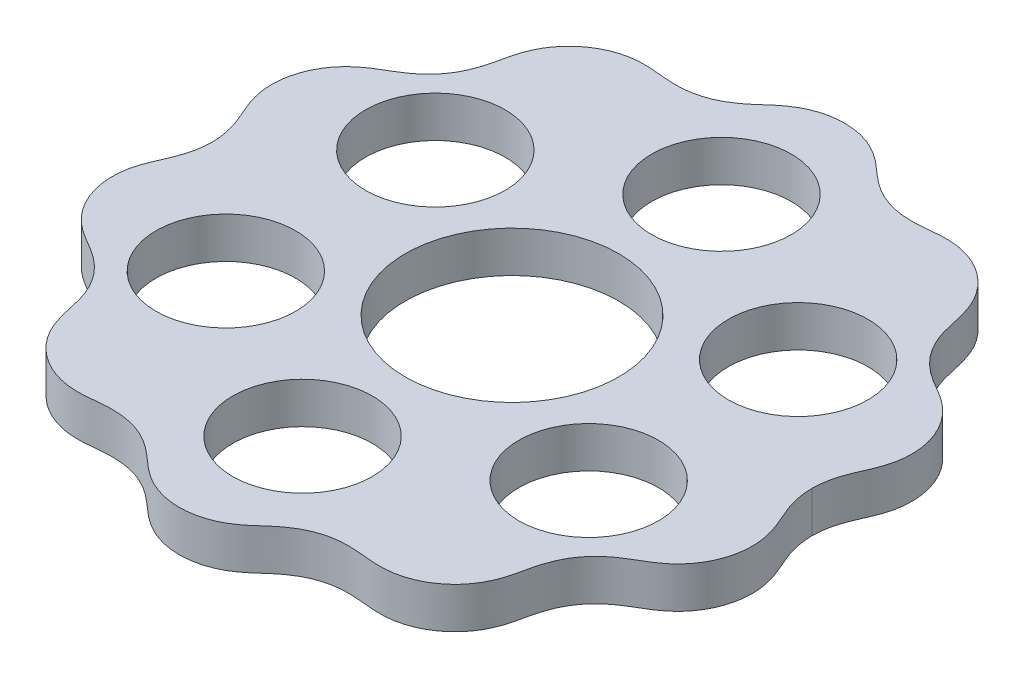
from build123d import *

# Parameters (mm, degrees)
SKETCH1_R           = 13
SKETCH1_R_2         = 8.5
BOSS_EXTRUDE1_DEPTH = 5


with BuildPart() as part:
    # Sketch1 → Boss-Extrude1 (new body)
    with BuildSketch(Plane(origin=(0, 0, 0), x_dir=(1, 0, 0), z_dir=(0, 1, 0))):
        with BuildLine():
            add(Edge.make_bspline(
                [(36.5, 0), (36.5, -0.048499305), (36.500946474, -0.144120136), (36.505205639, -0.349195993), (36.516548144, -0.571582738), (36.53776893, -0.854430115), (36.574407998, -1.196752002), (36.62809738, -1.556988295), (36.70127876, -1.938208043), (36.78047365, -2.281954505), (36.861329003, -2.590026625), (36.973593296, -2.971756615), (37.124850001, -3.424875263), (37.335057521, -3.978884819), (37.610804689, -4.630454515), (37.912979272, -5.308786827), (38.217993537, -6.024773331), (38.579337976, -7.000673113), (38.903566381, -8.266221267), (39.040360932, -9.835827251), (38.833195825, -11.619336074), (38.300146641, -13.287501244), (37.486961222, -14.788321278), (36.519443961, -15.985374971), (35.463247749, -16.921686084), (34.480633006, -17.584395869), (33.651986164, -18.070393448), (32.741397785, -18.599880286), (31.745814237, -19.23037768), (30.644081106, -20.103969946), (29.551914438, -21.316953148), (28.709876259, -22.688378726), (28.129188952, -24.127329092), (27.764036764, -25.53676255), (27.498568237, -26.872010136), (27.14459296, -28.24566423), (26.585858616, -29.613191611), (25.753833767, -30.946724523), (24.630275661, -32.173887031), (23.304067671, -33.178476098), (21.818707229, -33.928039056), (20.354428633, -34.356223626), (18.980021188, -34.522492919), (17.810145148, -34.508679014), (16.856619883, -34.426627197), (15.978233577, -34.333926373), (15.170927755, -34.265741371), (14.149802015, -34.229580128), (12.916311546, -34.297819177), (11.49268827, -34.581382628), (10.018707632, -35.167894044), (8.730716825, -35.94686999), (7.616704888, -36.833430943), (6.627661642, -37.741061624), (5.549118095, -38.667467053), (4.288853719, -39.488783224), (2.83273482, -40.115486753), (1.209906645, -40.482844808), (-0.452411505, -40.551448925), (-2.099959875, -40.319988007), (-3.516029788, -39.847376882), (-4.684831629, -39.236604984), (-5.595122009, -38.603332332), (-6.291293195, -38.03136891), (-6.935196982, -37.455611034), (-7.552937159, -36.905280935), (-8.3720822, -36.227490452), (-9.417339699, -35.501645102), (-10.744745036, -34.835364198), (-12.274940897, -34.396213159), (-13.568324156, -34.246071291), (-14.609253635, -34.240736665), (-15.418369646, -34.285553755), (-16.096609715, -34.346726816), (-16.983957337, -34.439047454), (-18.129700574, -34.534198807), (-19.514247662, -34.499663354), (-21.100124923, -34.177722278), (-22.642688121, -33.554292595), (-24.047237509, -32.662289917), (-25.268485598, -31.532537595), (-26.154336533, -30.347709032), (-26.756076077, -29.20476342), (-27.137211283, -28.192212286), (-27.376331213, -27.351346043), (-27.564158904, -26.521994318), (-27.736255611, -25.71290243), (-27.9936462, -24.634267957), (-28.399117079, -23.379440462), (-29.076792687, -22.004837755), (-30.054056647, -20.718767709), (-31.078771932, -19.746027017), (-32.039482, -19.04146275), (-32.864050638, -18.52796692), (-33.790814113, -17.989908183), (-34.820371489, -17.38242567), (-35.961313043, -16.537601472), (-37.086556652, -15.342606474), (-37.986548491, -13.943319085), (-38.618524242, -12.404128407), (-38.963667013, -10.776717844), (-39.002753109, -9.320975979), (-38.844934454, -8.085734909), (-38.592561063, -7.081267912), (-38.326228914, -6.29696863), (-38.011335485, -5.531557624), (-37.674927383, -4.77594876), (-37.378377228, -4.087797522), (-37.136778411, -3.461265107), (-36.948914251, -2.898248212), (-36.825242681, -2.464456921), (-36.734418474, -2.088562142), (-36.661575892, -1.734972023), (-36.604229284, -1.403741901), (-36.561095025, -1.084527578), (-36.530996656, -0.773408388), (-36.51357757, -0.520248866), (-36.504270411, -0.30979969), (-36.50077644, -0.13220069), (-36.5, -0.043927313), (-36.5, 0)],
                knots=[0.075291946, 0.075291946, 0.075291946, 0.075291946, 0.075291946, 0.076789614, 0.078287282, 0.07978495, 0.081282618, 0.084277954, 0.08727329, 0.089360772, 0.091448255, 0.093535738, 0.09562322, 0.099798186, 0.103973151, 0.109075131, 0.11417711, 0.11927909, 0.12438107, 0.136358468, 0.148336576, 0.160314307, 0.171165011, 0.182015901, 0.19286658, 0.200455433, 0.208044287, 0.213054353, 0.21806442, 0.228084552, 0.238937008, 0.249793369, 0.260645765, 0.270063658, 0.279481551, 0.287924265, 0.29636698, 0.307216588, 0.31806735, 0.328918293, 0.339769011, 0.350619262, 0.361470141, 0.368707076, 0.375944011, 0.381255238, 0.386566466, 0.391877694, 0.397188922, 0.408043704, 0.418896938, 0.42975045, 0.43856656, 0.447382671, 0.456176825, 0.464970979, 0.475821103, 0.486671615, 0.497522231, 0.508373237, 0.519223851, 0.530073652, 0.536457884, 0.542842116, 0.54826674, 0.553691365, 0.55911599, 0.564540614, 0.576145954, 0.586999876, 0.597853142, 0.606065959, 0.610172367, 0.614278775, 0.619102733, 0.62392669, 0.633574604, 0.644425041, 0.655275871, 0.666126278, 0.676977072, 0.687828191, 0.698678662, 0.70471008, 0.710741499, 0.716165428, 0.721589356, 0.727013285, 0.732437214, 0.745249936, 0.756104619, 0.766960924, 0.774569677, 0.78217843, 0.787303815, 0.7924292, 0.802679969, 0.813530568, 0.824380707, 0.835231117, 0.846082101, 0.856932921, 0.867783145, 0.873212041, 0.878640937, 0.884065114, 0.889489291, 0.894913468, 0.900337645, 0.90371728, 0.907096914, 0.910476548, 0.912166365, 0.913856182, 0.91656915, 0.919282118, 0.920638602, 0.921995086, 0.92335157, 0.924708054, 0.924708054, 0.924708054, 0.924708054, 0.924708054], degree=4))
            add(Edge.make_bspline(
                [(-36.5, 0), (-36.5, 0.048499305), (-36.500709854, 0.120347377), (-36.503076032, 0.248821581), (-36.509459135, 0.430805007), (-36.518670462, 0.600909868), (-36.537767816, 0.853780444), (-36.574410609, 1.197161726), (-36.628092737, 1.556776711), (-36.70128534, 1.938275134), (-36.798317842, 2.359473017), (-36.924362877, 2.820443145), (-37.096624147, 3.350360221), (-37.335050856, 3.978935622), (-37.610808448, 4.630425207), (-37.912977339, 5.30880264), (-38.217994227, 6.024766679), (-38.579337761, 7.000676775), (-38.903566296, 8.266218611), (-39.040361318, 9.835829449), (-38.83319516, 11.619334121), (-38.300147751, 13.287503552), (-37.486959297, 14.788317854), (-36.51944727, 15.985380477), (-35.463241983, 16.921676737), (-34.480643682, 17.584412987), (-33.651966589, 18.070362205), (-32.906545987, 18.503912569), (-32.256987734, 18.906587709), (-31.445352143, 19.468675663), (-30.515561037, 20.246660688), (-29.551926436, 21.316972253), (-28.709868851, 22.688366931), (-28.129194123, 24.127337321), (-27.764033611, 25.53675754), (-27.498569959, 26.872012871), (-27.144592106, 28.24566287), (-26.585859124, 29.613192421), (-25.753833457, 30.946724029), (-24.630275847, 32.173887326), (-23.304067555, 33.178475912), (-21.818707307, 33.928039181), (-20.354428582, 34.356223545), (-18.980021222, 34.522492971), (-17.810145124, 34.508678977), (-16.856619896, 34.426627224), (-15.978233572, 34.333926353), (-15.170927757, 34.265741379), (-14.149802015, 34.229580123), (-12.916311545, 34.29781918), (-11.492688271, 34.581382626), (-10.018707631, 35.167894044), (-8.730716827, 35.94686999), (-7.616704884, 36.833430941), (-6.627661644, 37.741061623), (-5.549118097, 38.667467054), (-4.288853718, 39.488783222), (-2.832734821, 40.115486753), (-1.209906645, 40.482844807), (0.452411504, 40.551448925), (2.099959876, 40.319988007), (3.516029787, 39.847376881), (4.68483163, 39.236604984), (5.595122006, 38.60333233), (6.291293204, 38.031368915), (6.935196973, 37.455611027), (7.552937162, 36.905280937), (8.372082197, 36.227490449), (9.417339701, 35.501645103), (10.744745035, 34.835364195), (12.274940897, 34.396213161), (13.568324156, 34.246071287), (14.609253634, 34.240736671), (15.418369647, 34.285553746), (16.096609716, 34.346726821), (16.983957335, 34.439047449), (18.129700573, 34.534198813), (19.514247663, 34.499663349), (21.100124923, 34.17772228), (22.642688121, 33.554292593), (24.047237508, 32.662289917), (25.268485599, 31.532537594), (26.154336531, 30.347709032), (26.756076079, 29.204763419), (27.137211278, 28.192212287), (27.376331225, 27.351346041), (27.564158894, 26.521994319), (27.736255613, 25.712902429), (27.993646196, 24.634267958), (28.399117082, 23.37944046), (29.076792686, 22.004837756), (30.054056648, 20.718767707), (31.078771932, 19.74602702), (32.039481999, 19.041462745), (32.864050639, 18.527966924), (33.790814111, 17.98990817), (34.82037149, 17.382425694), (35.961313043, 16.537601441), (37.086556651, 15.342606512), (37.986548494, 13.94331903), (38.618524236, 12.404128495), (38.963667022, 10.77671769), (39.002753094, 9.320976227), (38.844934477, 8.085734521), (38.592561023, 7.081268579), (38.32622901, 6.296967044), (38.011335306, 5.531560737), (37.674927708, 4.775943023), (37.37837668, 4.087807125), (37.136779297, 3.461249479), (36.969310994, 2.959402658), (36.860578901, 2.58836954), (36.779829118, 2.276540793), (36.721424729, 2.02544297), (36.661575157, 1.735036695), (36.604229765, 1.403615039), (36.561094779, 1.084737296), (36.530996745, 0.773135873), (36.515319468, 0.545818588), (36.507760589, 0.388500267), (36.502523425, 0.222042212), (36.500582329, 0.109223844), (36.5, 0.043927313), (36.5, 0)],
                knots=[0.075291946, 0.075291946, 0.075291946, 0.075291946, 0.075291946, 0.076789614, 0.077538448, 0.078287282, 0.07978495, 0.081282618, 0.084277954, 0.08727329, 0.089360772, 0.091448255, 0.09562322, 0.099798186, 0.103973151, 0.109075131, 0.11417711, 0.11927909, 0.12438107, 0.136358468, 0.148336576, 0.160314307, 0.171165011, 0.182015901, 0.19286658, 0.200455433, 0.208044287, 0.213054353, 0.21806442, 0.223074486, 0.228084552, 0.238937008, 0.249793369, 0.260645765, 0.270063658, 0.279481551, 0.287924265, 0.29636698, 0.307216588, 0.31806735, 0.328918293, 0.339769011, 0.350619262, 0.361470141, 0.368707076, 0.375944011, 0.381255238, 0.386566466, 0.391877694, 0.397188922, 0.408043704, 0.418896938, 0.42975045, 0.43856656, 0.447382671, 0.456176825, 0.464970979, 0.475821103, 0.486671615, 0.497522231, 0.508373237, 0.519223851, 0.530073652, 0.536457884, 0.542842116, 0.54826674, 0.553691365, 0.55911599, 0.564540614, 0.576145954, 0.586999876, 0.597853142, 0.606065959, 0.610172367, 0.614278775, 0.619102733, 0.62392669, 0.633574604, 0.644425041, 0.655275871, 0.666126278, 0.676977072, 0.687828191, 0.698678662, 0.70471008, 0.710741499, 0.716165428, 0.721589356, 0.727013285, 0.732437214, 0.745249936, 0.756104619, 0.766960924, 0.774569677, 0.78217843, 0.787303815, 0.7924292, 0.802679969, 0.813530568, 0.824380707, 0.835231117, 0.846082101, 0.856932921, 0.867783145, 0.873212041, 0.878640937, 0.884065114, 0.889489291, 0.894913468, 0.900337645, 0.90371728, 0.907096914, 0.908786731, 0.910476548, 0.912166365, 0.913856182, 0.91656915, 0.919282118, 0.920638602, 0.921995086, 0.922673328, 0.92335157, 0.924708054, 0.924708054, 0.924708054, 0.924708054, 0.924708054], degree=4))
        make_face()
        with Locations(Location((0, 0, 0), (0, 0, 270))):
            Circle(SKETCH1_R, mode=Mode.SUBTRACT)
        with Locations(Location((0, 25.5, 0), (0, 0, 270))):
            Circle(SKETCH1_R_2, mode=Mode.SUBTRACT)
        with Locations(Location((22.083647797, 12.75, 0), (0, 0, 270))):
            Circle(SKETCH1_R_2, mode=Mode.SUBTRACT)
        with Locations(Location((22.083647797, -12.75, 0), (0, 0, 270))):
            Circle(SKETCH1_R_2, mode=Mode.SUBTRACT)
        with Locations(Location((0, -25.5, 0), (0, 0, 270))):
            Circle(SKETCH1_R_2, mode=Mode.SUBTRACT)
        with Locations(Location((-22.083647797, -12.75, 0), (0, 0, 270))):
            Circle(SKETCH1_R_2, mode=Mode.SUBTRACT)
        with Locations(Location((-22.083647797, 12.75, 0), (0, 0, 270))):
            Circle(SKETCH1_R_2, mode=Mode.SUBTRACT)
    extrude(amount=BOSS_EXTRUDE1_DEPTH)


solid = part.part
